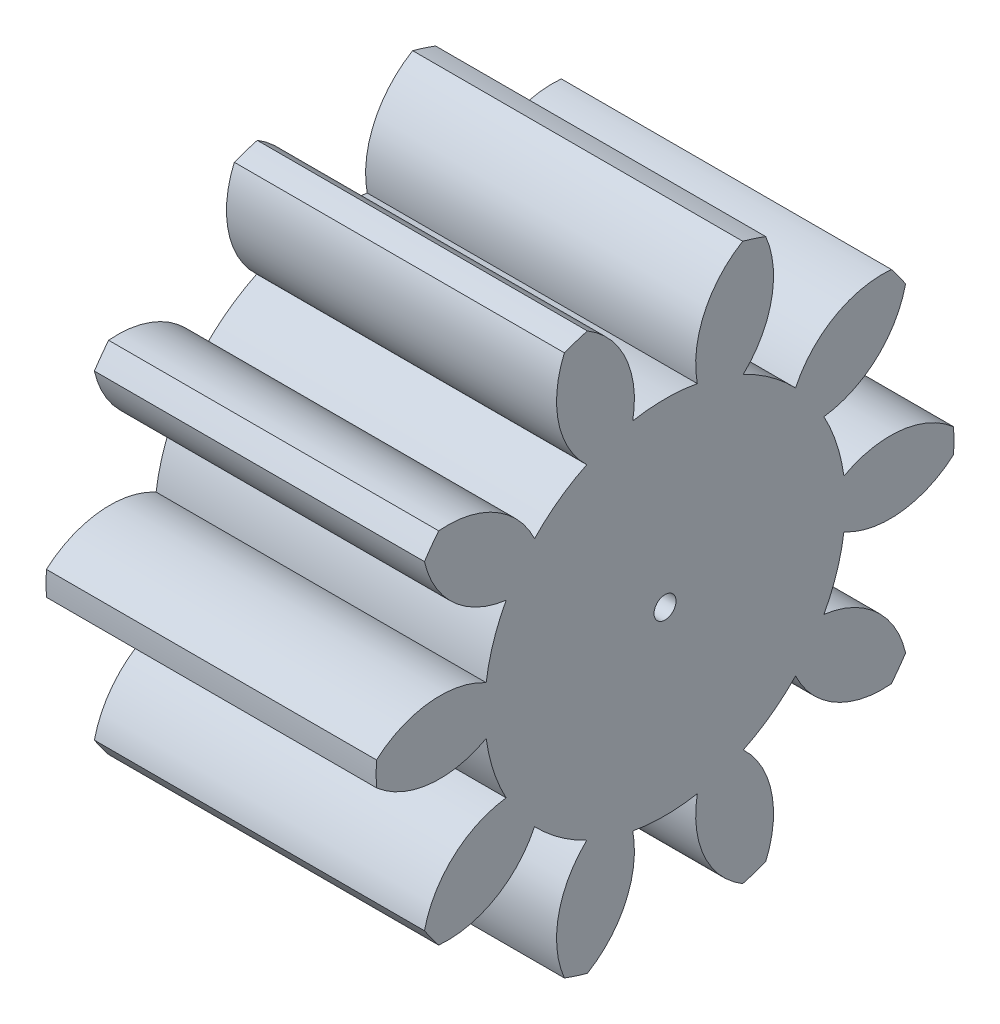
from build123d import *

# Parameters (mm, degrees)
BASPROSKE_W     = 12
BASPROSKE_H     = 10.5
TOOTHCUT_DEPTH  = 20.091883092
TEETHCUTS_COUNT = 10
TEETHCUTS_ANGLE = 324
BORSKE_R        = 0.4
BORE_DEPTH      = 50.0000508


with BuildPart() as part:
    # BasProSke → Base-Revolve (revolve)
    with BuildSketch(Plane(origin=(0, 0, 0), x_dir=(1, 0, 0), z_dir=(0, 1, 0)), mode=Mode.PRIVATE) as base_revolve_sk:
        with Locations((6, 5.25)):
            Rectangle(BASPROSKE_W, BASPROSKE_H)
    revolve(base_revolve_sk.sketch.rotate(Axis((-10, 0, 0), (1, 0, 0)), 180), axis=Axis((-10, 0, 0), (1, 0, 0)))

    # TooCutSke → ToothCut (cut, through all)
    with BuildSketch(Plane(origin=(0, 0, 0), x_dir=(0, 0, -1), z_dir=(1, 0, 0))):
        with BuildLine():
            ThreePointArc((1.173901537, 6.455636098), (0, 6.5615), (-1.173901537, 6.455636098))
            ThreePointArc((-1.173901537, 6.455636098), (-1.430021039, 8.560346018), (-2.854248526, 10.131007379))
            ThreePointArc((-2.854248526, 10.131007379), (0, 10.5254), (2.854248526, 10.131007379))
            ThreePointArc((2.854248526, 10.131007379), (1.430021039, 8.560346018), (1.173901537, 6.455636098))
        make_face()
    toothcut = extrude(amount=TOOTHCUT_DEPTH, mode=Mode.SUBTRACT)

    # TeethCuts: ToothCut ×10 about axis
    teethcuts_axis = Axis((-10, 0, 0), (1, 0, 0))
    for i in range(1, TEETHCUTS_COUNT):
        add(toothcut.rotate(teethcuts_axis, i * TEETHCUTS_ANGLE / (TEETHCUTS_COUNT - 1)), mode=Mode.SUBTRACT)

    # BorSke → Bore (cut, symmetric)
    with BuildSketch(Plane(origin=(0, 0, 0), x_dir=(0, 0, -1), z_dir=(1, 0, 0))):
        with Locations(Location((0, 0, 0), (0, 0, 180))):
            Circle(BORSKE_R)
    extrude(amount=BORE_DEPTH, both=True, mode=Mode.SUBTRACT)


solid = part.part
